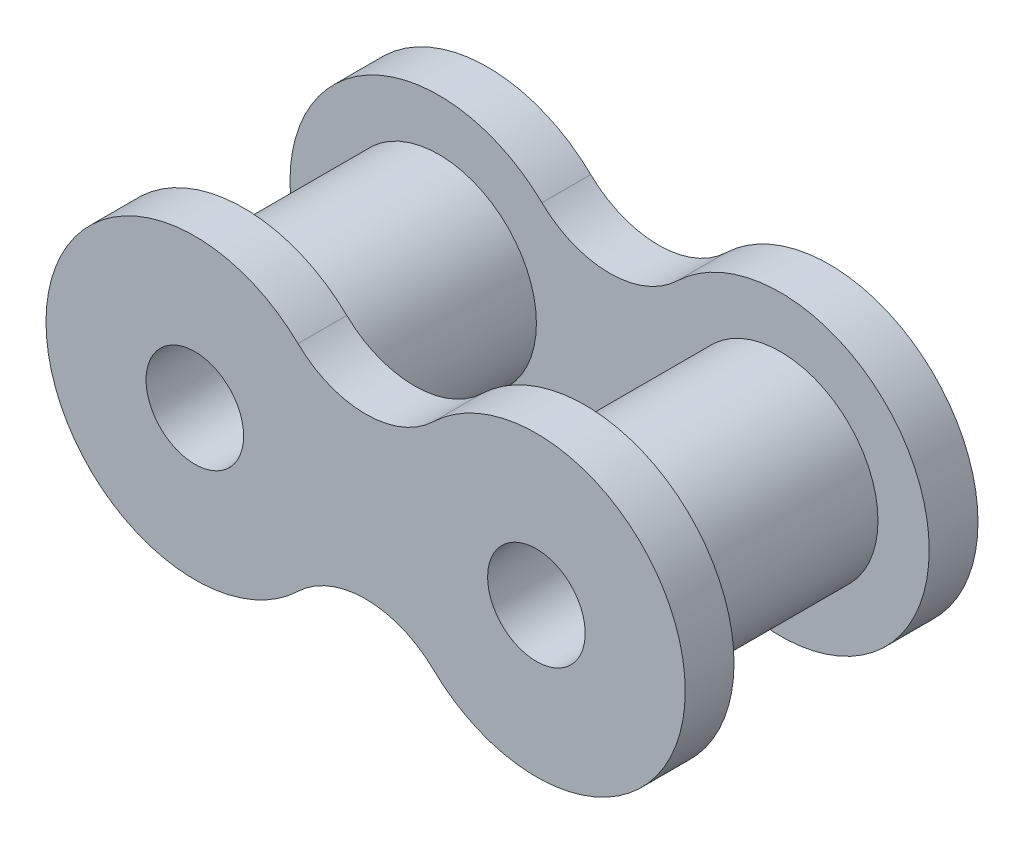
from build123d import *

# Parameters (mm, degrees)
CROQUIS1_R              = 2
SALIENTE_EXTRUIR1_DEPTH = 2
CROQUIS2_R              = 4
CROQUIS2_R_2            = 2
SALIENTE_EXTRUIR2_DEPTH = 8


with BuildPart() as part:
    # Croquis1 → Saliente-Extruir1 (new body)
    with BuildSketch(Plane.XY):
        with BuildLine():
            ThreePointArc((-2.772277228, 4.397312834), (-13.1, 0), (-2.772277228, -4.397312834))
            ThreePointArc((-2.772277228, -4.397312834), (0, -3.28079666), (2.772277228, -4.397312834))
            ThreePointArc((2.772277228, -4.397312834), (13.1, 0), (2.772277228, 4.397312834))
            ThreePointArc((2.772277228, 4.397312834), (0, 3.28079666), (-2.772277228, 4.397312834))
        make_face()
        with Locations((-7, 0)):
            Circle(CROQUIS1_R, mode=Mode.SUBTRACT)
        with Locations(Location((7, 0, 0), (0, 0, 180))):
            Circle(CROQUIS1_R, mode=Mode.SUBTRACT)
    saliente_extruir1 = extrude(amount=SALIENTE_EXTRUIR1_DEPTH)

    # Croquis2 → Saliente-Extruir2 (add)
    # profile 1 of 2: a face of its own
    with BuildSketch(Plane.XY.offset(2)):
        with Locations((-7, 0)):
            Circle(CROQUIS2_R)
        with Locations((-7, 0)):
            Circle(CROQUIS2_R_2, mode=Mode.SUBTRACT)
    # profile 2 of 2: a face of its own
    with BuildSketch(Plane.XY.offset(2)):
        with Locations((7, 0)):
            Circle(CROQUIS2_R)
        with Locations(Location((7, 0, 0), (0, 0, 180))):
            Circle(CROQUIS2_R_2, mode=Mode.SUBTRACT)
    extrude(amount=SALIENTE_EXTRUIR2_DEPTH)

    # Simetría1: Saliente-Extruir1 across plane
    add(saliente_extruir1.mirror(Plane.XY.offset(6)))


solid = part.part
